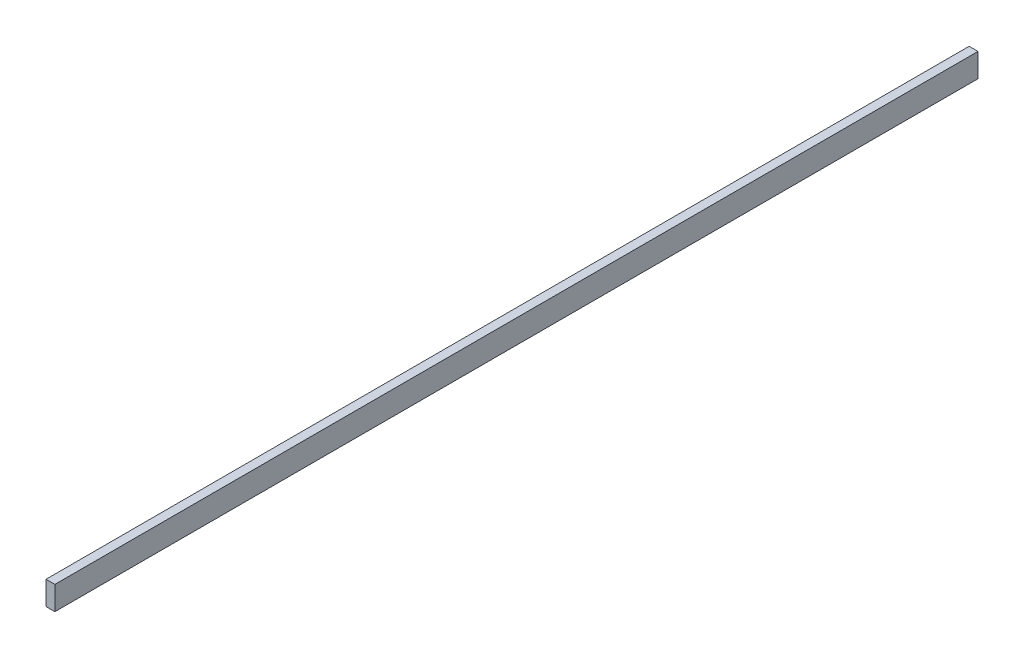
from build123d import *

# Parameters (mm, degrees)
SKETCH1_W           = 8
SKETCH1_H           = 312
BOSS_EXTRUDE1_DEPTH = 1.5


with BuildPart() as part:
    # Sketch1 → Boss-Extrude1 (new, symmetric)
    with BuildSketch(Plane.YZ):
        Rectangle(SKETCH1_W, SKETCH1_H)
    extrude(amount=BOSS_EXTRUDE1_DEPTH, both=True)


solid = part.part
